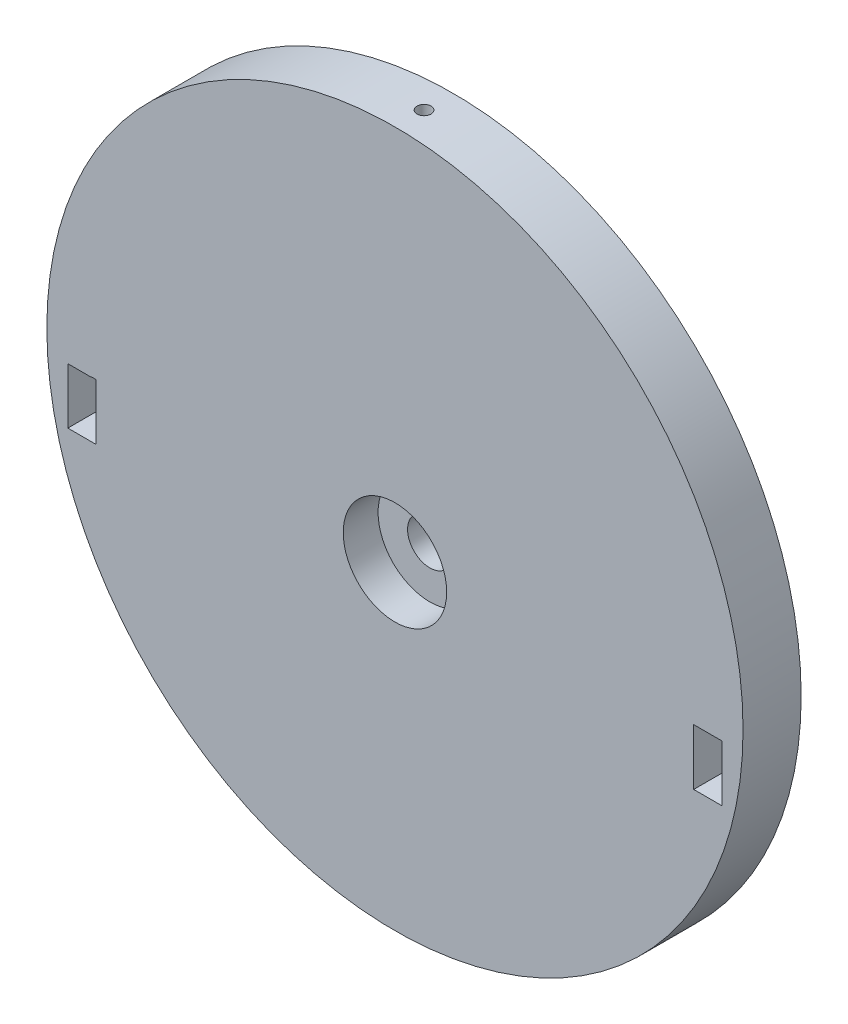
from build123d import *

# Parameters (mm, degrees)
SKETCH1_R           = 76.073
SKETCH1_R_2         = 4.8641
BOSS_EXTRUDE1_DEPTH = 12.7
SKETCH2_W           = 6.1976
SKETCH2_H           = 12.2682
CUT_EXTRUDE1_DEPTH  = 109.330478897
SKETCH3_R           = 11.303
CUT_EXTRUDE2_DEPTH  = 7.62
CUT_EXTRUDE3_START  = 76.073
SKETCH5_R           = 1.524
CUT_EXTRUDE3_DEPTH  = 6.35
CUT_EXTRUDE4_START  = -69.723
SKETCH6_R           = 1.524
CUT_EXTRUDE4_DEPTH  = 6.35


with BuildPart() as part:
    # Sketch1 → Boss-Extrude1 (new body)
    with BuildSketch(Plane.XY):
        Circle(SKETCH1_R)
        with Locations((0, -6.35)):
            Circle(SKETCH1_R_2, mode=Mode.SUBTRACT)
    extrude(amount=BOSS_EXTRUDE1_DEPTH)

    # Sketch2 → Cut-Extrude1 (cut, through all)
    with BuildSketch(Plane.XY.offset(12.7)):
        with Locations((68.3851714, -10.5537)):
            Rectangle(SKETCH2_W, SKETCH2_H)
        Polygon((-71.4839714, -4.4958), (-71.4839714, -16.6878), (-65.2863714, -16.6878), (-65.2863714, -4.4196), (-66.357360373, -4.4196), (-66.357360373, -4.4958), align=None)
    extrude(amount=-CUT_EXTRUDE1_DEPTH, mode=Mode.SUBTRACT)

    # Sketch3 → Cut-Extrude2 (cut)
    with BuildSketch(Plane.XY.offset(12.7)):
        with Locations((0, -6.35)):
            Circle(SKETCH3_R)
    extrude(amount=-CUT_EXTRUDE2_DEPTH, mode=Mode.SUBTRACT)

    # Sketch5 → Cut-Extrude3 (cut)
    with BuildSketch(Plane(origin=(0, 0, 0), x_dir=(1, 0, 0), z_dir=(0, 1, 0)).offset(CUT_EXTRUDE3_START)):
        with Locations(Location((0, -6.35, 0), (0, 0, 270))):
            Circle(SKETCH5_R)
    extrude(amount=-CUT_EXTRUDE3_DEPTH, mode=Mode.SUBTRACT)

    # Sketch6 → Cut-Extrude4 (cut)
    with BuildSketch(Plane(origin=(0, 0, 0), x_dir=(1, 0, 0), z_dir=(0, 1, 0)).offset(CUT_EXTRUDE4_START)):
        with Locations(Location((0, -6.35, 0), (0, 0, 270))):
            Circle(SKETCH6_R)
    extrude(amount=-CUT_EXTRUDE4_DEPTH, mode=Mode.SUBTRACT)


solid = part.part
